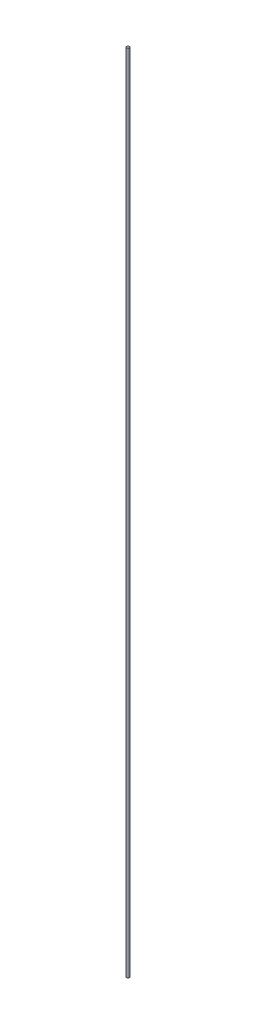
from build123d import *

# Parameters (mm, degrees)
SKIZZE1_R                       = 1
AUFSATZ_LINEAR_AUSTRAGEN1_DEPTH = 600


with BuildPart() as part:
    # Skizze1 → Aufsatz-Linear austragen1 (new body)
    with BuildSketch(Plane(origin=(0, 0, 0), x_dir=(1, 0, 0), z_dir=(0, 1, 0))):
        Circle(SKIZZE1_R)
    extrude(amount=AUFSATZ_LINEAR_AUSTRAGEN1_DEPTH)


solid = part.part
